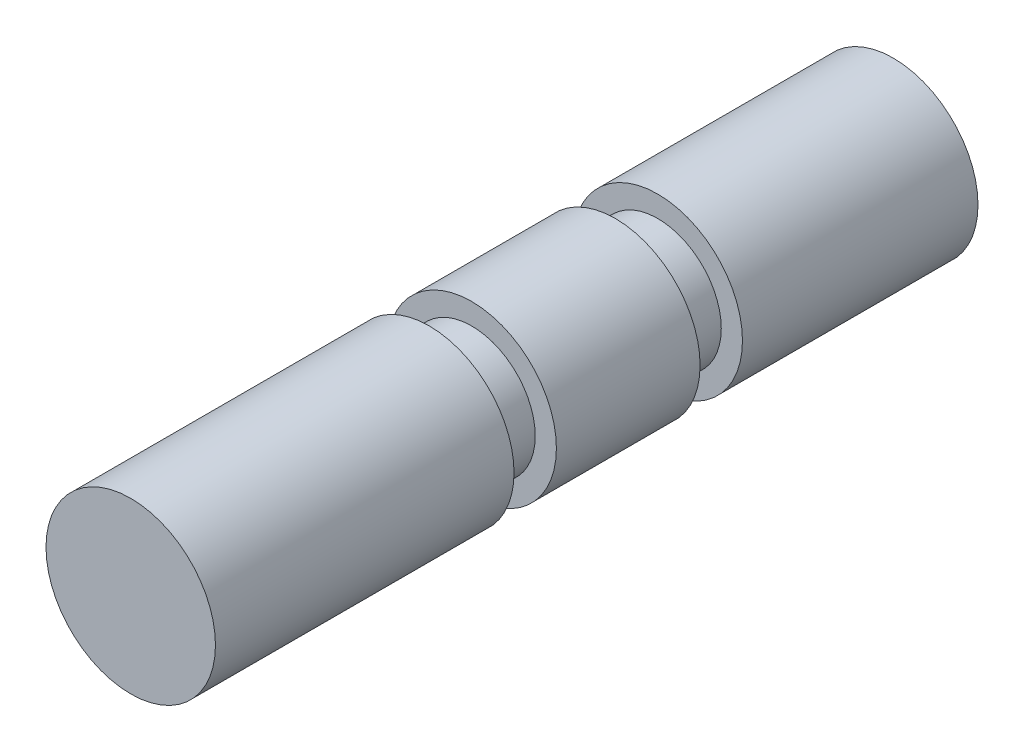
from build123d import *

# Parameters (mm, degrees)
CUT_EXTRUDE1_START = -250
SKETCH3_R          = 50
CUT_EXTRUDE1_DEPTH = 250


with BuildPart() as part:
    # Sketch2 → Revolve1 (revolve)
    with BuildSketch(Plane(origin=(0, 0, 0), x_dir=(0, 0, -1), z_dir=(1, 0, 0)), mode=Mode.PRIVATE) as revolve1_sk:
        Polygon((0, 0), (0, 50), (426.2, 50), (426.2, 37.5), (451.2, 37.5), (451.2, 50), (536, 50), (536, 37.5), (561, 37.5), (561, 50), (700, 50), (700, 0), align=None)
    revolve(revolve1_sk.sketch.rotate(Axis((0, 0, 0), (0, 0, -1)), 90), axis=Axis((0, 0, 0), (0, 0, -1)))

    # Sketch3 → Cut-Extrude1 (cut)
    with BuildSketch(Plane.XY.offset(CUT_EXTRUDE1_START)):
        Circle(SKETCH3_R)
    extrude(amount=CUT_EXTRUDE1_DEPTH, mode=Mode.SUBTRACT)


solid = part.part
